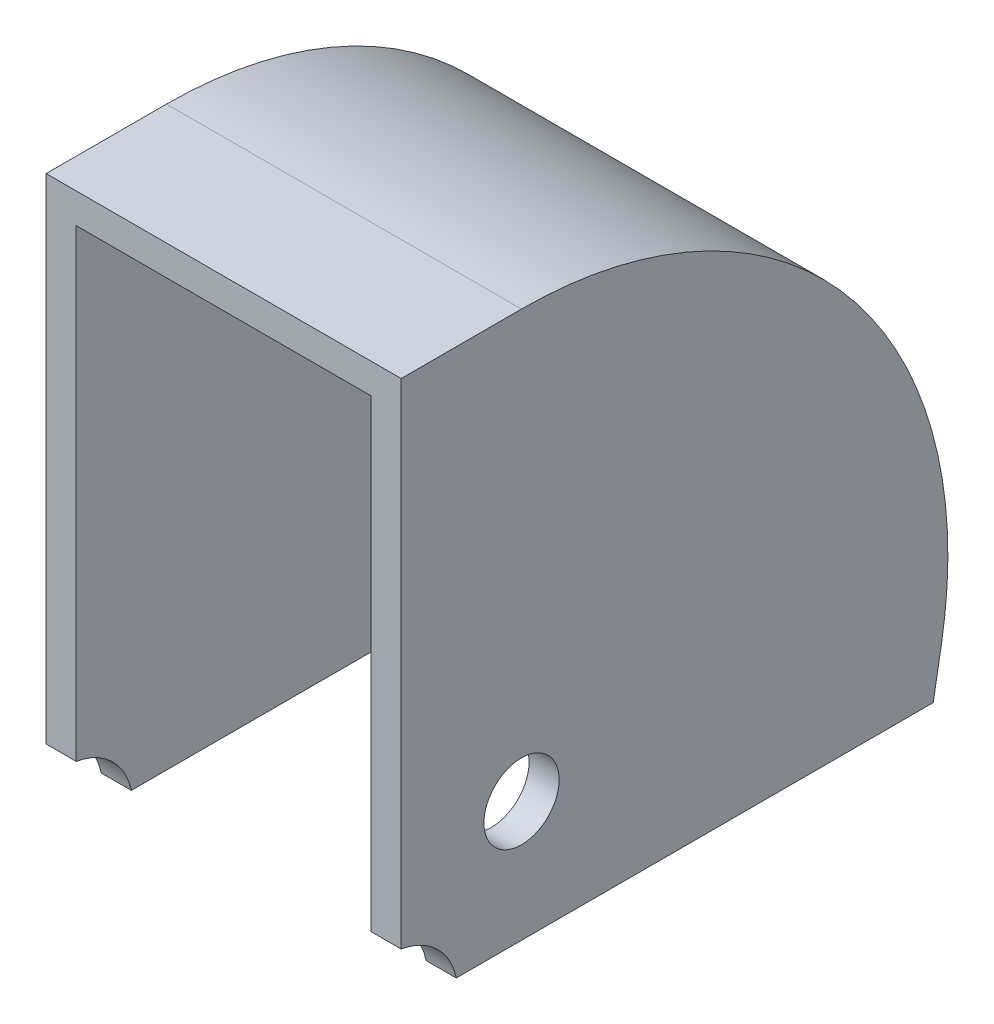
from build123d import *

# Parameters (mm, degrees)
BOSS_EXTRUDE1_DEPTH = 2
BOSS_EXTRUDE2_START = 9.79671523
BOSS_EXTRUDE2_DEPTH = 9.79671523
SKETCH4_R           = 2.5
CUT_EXTRUDE5_DEPTH  = 13


with BuildPart() as part:
    # Sketch1 → Boss-Extrude1 (new body)
    with BuildSketch(Plane(origin=(0, 0, 0), x_dir=(0, 0, -1), z_dir=(1, 0, 0))):
        with BuildLine():
            Line((-8, -4.5), (-8, 28.33511482))
            Line((-8, 28.33511482), (0, 28.33511482))
            ThreePointArc((0, 28.33511482), (21.705957253, 18.213460725), (27.904640757, -4.920341052))
            Line((27.904640757, -4.920341052), (27.361613793, -8))
            Line((27.361613793, -8), (-4.335665421, -8))
            ThreePointArc((-4.335665421, -8), (-5.628363986, -5.685201742), (-8, -4.5))
        make_face()
    extrude(amount=BOSS_EXTRUDE1_DEPTH)

    # Sketch6 → Boss-Extrude2 (add)
    with BuildSketch(Plane.ZY.offset(BOSS_EXTRUDE2_START)):
        with BuildLine():
            Line((8, 26.33511482), (0, 26.33511482))
            ThreePointArc((0, 26.33511482), (-20.173868367, 16.927885506), (-25.935025251, -4.573044697))
            Line((-25.935025251, -4.573044697), (-25.33076057, -8))
            Line((-25.33076057, -8), (-27.361613793, -8))
            Line((-27.361613793, -8), (-27.904640757, -4.920341052))
            ThreePointArc((-27.904640757, -4.920341052), (-21.705957253, 18.213460725), (0, 28.33511482))
            Line((0, 28.33511482), (8, 28.33511482))
            Line((8, 28.33511482), (8, 26.33511482))
        make_face()
    extrude(amount=-BOSS_EXTRUDE2_DEPTH)

    # Mirror1: part across plane


with BuildPart() as part_1:
    add(part.part)
    add(part.part.mirror(Plane.ZY.offset(9.79671523)))

    # Sketch4 → Cut-Extrude5 (cut)
    with BuildSketch(Plane(origin=(2, 0, 0), x_dir=(0, 0, -1), z_dir=(1, 0, 0))):
        Circle(SKETCH4_R)
    extrude(amount=-CUT_EXTRUDE5_DEPTH, mode=Mode.SUBTRACT)


solid = part_1.part
